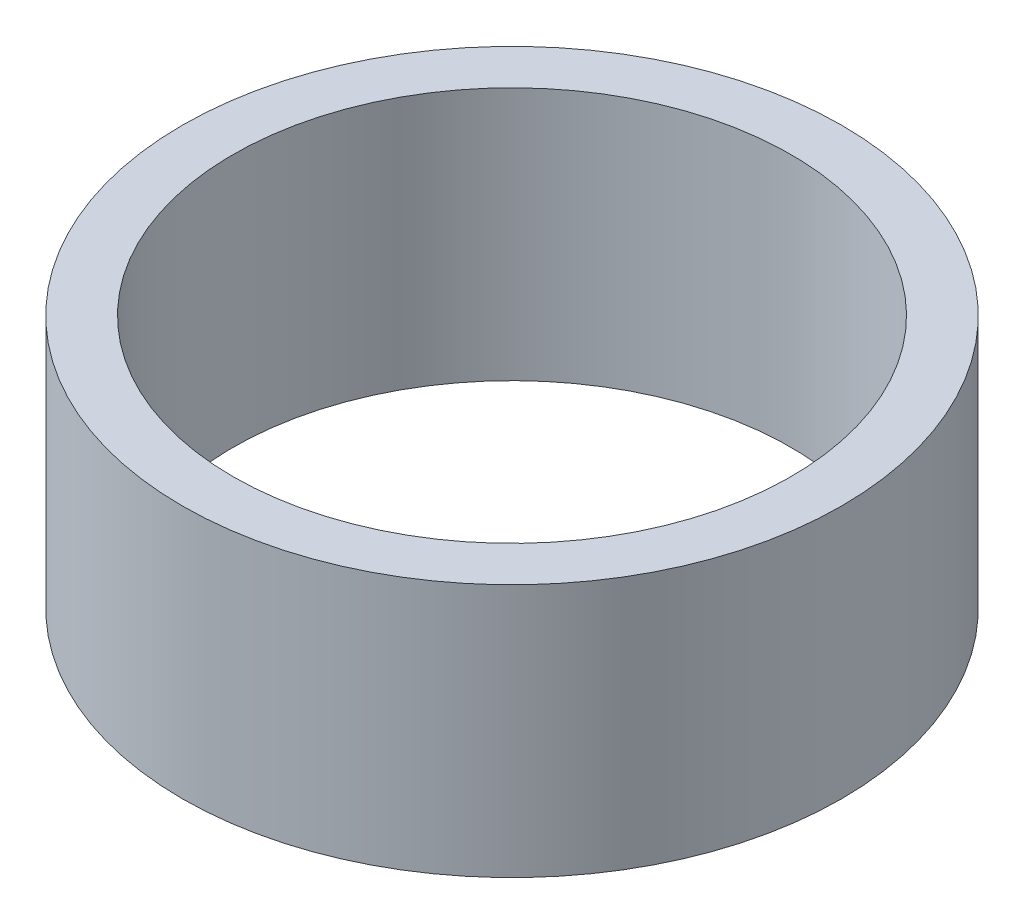
from build123d import *

# Parameters (mm, degrees)
SKETCH1_R           = 13
SKETCH1_R_2         = 11
BOSS_EXTRUDE1_DEPTH = 10


with BuildPart() as part:
    # Sketch1 → Boss-Extrude1 (new body)
    with BuildSketch(Plane(origin=(0, 0, 0), x_dir=(1, 0, 0), z_dir=(0, 1, 0))):
        with Locations(Location((0, 0, 0), (0, 0, 270))):
            Circle(SKETCH1_R)
        with Locations(Location((0, 0, 0), (0, 0, 270))):
            Circle(SKETCH1_R_2, mode=Mode.SUBTRACT)
    extrude(amount=BOSS_EXTRUDE1_DEPTH)


solid = part.part
